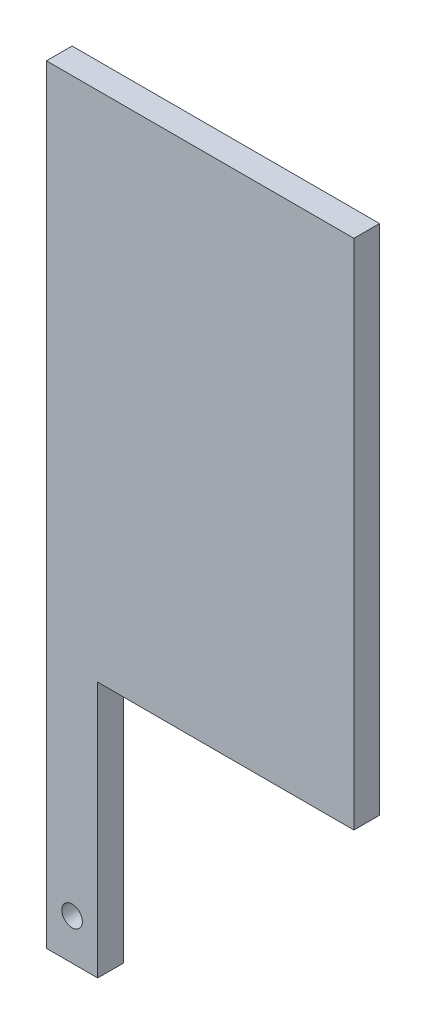
from build123d import *

# Parameters (mm, degrees)
BOSS_EXTRU_1_DEPTH      = 5
ESQUISSE2_W             = 60
ESQUISSE2_H             = 50
BOSS_EXTRU_2_DEPTH      = 5
ESQUISSE3_R             = 2
ENL_V_MAT_EXTRU_1_DEPTH = 5


with BuildPart() as part:
    # Esquisse1 → Boss.-Extru.1 (new body)
    with BuildSketch(Plane.XY):
        Polygon((60, -50), (0, -50), (0, -150), (10, -150), (10, -100), (60, -100), align=None)
    extrude(amount=BOSS_EXTRU_1_DEPTH)

    # Esquisse2 → Boss.-Extru.2 (add)
    with BuildSketch(Plane.XY.offset(5)):
        with Locations((30, -25)):
            Rectangle(ESQUISSE2_W, ESQUISSE2_H)
    extrude(amount=-BOSS_EXTRU_2_DEPTH)

    # Esquisse3 → Enlèv. mat.-Extru.1 (cut)
    with BuildSketch(Plane.XY.offset(5)):
        with Locations((5, -142)):
            Circle(ESQUISSE3_R)
    extrude(amount=-ENL_V_MAT_EXTRU_1_DEPTH, mode=Mode.SUBTRACT)


solid = part.part
